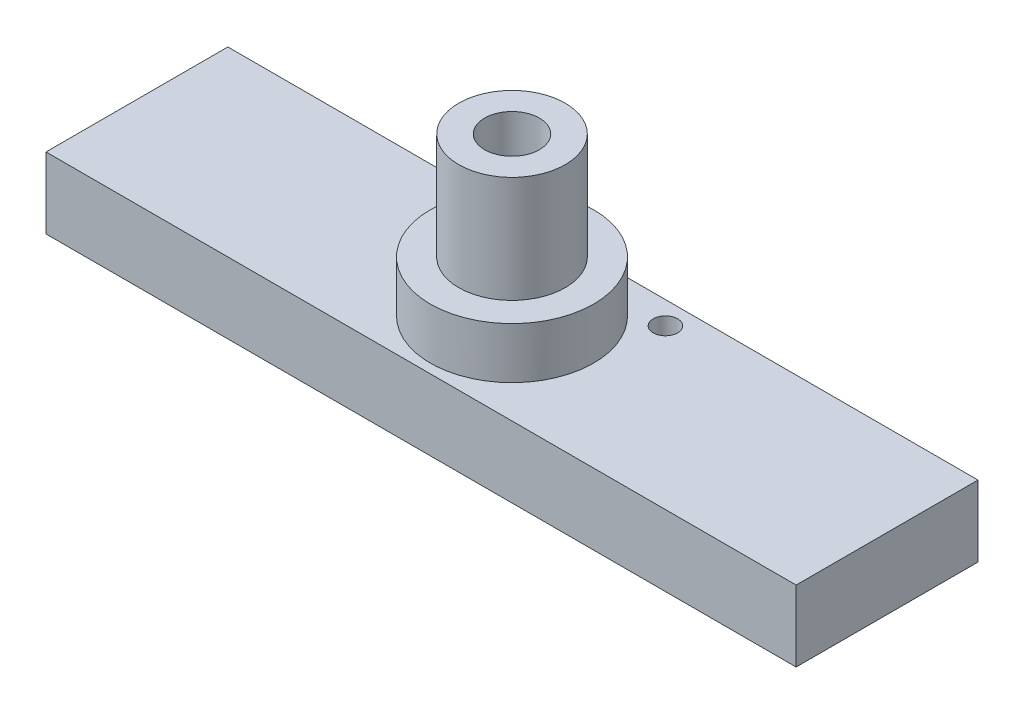
from build123d import *

# Parameters (mm, degrees)
SKETCH1_W           = 67.056
SKETCH1_H           = 16.256
BOSS_EXTRUDE1_DEPTH = 6.35
SKETCH2_R           = 4.7625
BOSS_EXTRUDE2_DEPTH = 14.097
SKETCH3_R           = 2.4511
CUT_EXTRUDE1_DEPTH  = 72.964188879
CUT_EXTRUDE2_REACH  = 73.964
SKETCH4_R           = 1.0922
SKETCH6_R           = 7.3025
SKETCH6_R_2         = 4.7625
BOSS_EXTRUDE3_DEPTH = 4.572


with BuildPart() as part:
    # Sketch1 → Boss-Extrude1 (new body)
    with BuildSketch(Plane(origin=(0, 0, 0), x_dir=(1, 0, 0), z_dir=(0, 1, 0))):
        with Locations((33.528, 8.128)):
            Rectangle(SKETCH1_W, SKETCH1_H)
    extrude(amount=BOSS_EXTRUDE1_DEPTH)

    # Sketch2 → Boss-Extrude2 (add)
    with BuildSketch(Plane(origin=(0, 6.35, 0), x_dir=(1, 0, 0), z_dir=(0, 1, 0))):
        with Locations(Location((33.528, 8.128, 0), (0, 0, 90))):
            Circle(SKETCH2_R)
    extrude(amount=BOSS_EXTRUDE2_DEPTH)

    # Sketch3 → Cut-Extrude1 (cut, through all)
    with BuildSketch(Plane(origin=(0, 20.447, 0), x_dir=(1, 0, 0), z_dir=(0, 1, 0))):
        with Locations(Location((33.528, 8.128, 0), (0, 0, 270))):
            Circle(SKETCH3_R)
    extrude(amount=-CUT_EXTRUDE1_DEPTH, mode=Mode.SUBTRACT)

    # Sketch4 → Cut-Extrude2 (cut, up to next)
    with BuildSketch(Plane(origin=(0, 0, 0), x_dir=(-1, 0, 0), z_dir=(0, -1, 0)), mode=Mode.PRIVATE) as cut_extrude2_sk1:
        with Locations(Location((-25.908, 14.224, 0), (0, 0, 90))):
            Circle(SKETCH4_R)
    cut_extrude2_tool1 = extrude(cut_extrude2_sk1.sketch, amount=-CUT_EXTRUDE2_REACH, mode=Mode.PRIVATE) & part.part
    # Sketch4 → Cut-Extrude2 (cut, up to next)
    with BuildSketch(Plane(origin=(0, 0, 0), x_dir=(-1, 0, 0), z_dir=(0, -1, 0)), mode=Mode.PRIVATE) as cut_extrude2_sk2:
        with Locations(Location((-41.148, 14.224, 0), (0, 0, 90))):
            Circle(SKETCH4_R)
    cut_extrude2_tool2 = extrude(cut_extrude2_sk2.sketch, amount=-CUT_EXTRUDE2_REACH, mode=Mode.PRIVATE) & part.part
    add(cut_extrude2_tool1.solids().sort_by_distance((25.908, 0, -14.224))[0], mode=Mode.SUBTRACT)
    add(cut_extrude2_tool2.solids().sort_by_distance((41.148, 0, -14.224))[0], mode=Mode.SUBTRACT)

    # Sketch6 → Boss-Extrude3 (add)
    with BuildSketch(Plane(origin=(0, 6.35, 0), x_dir=(1, 0, 0), z_dir=(0, 1, 0))):
        with Locations(Location((33.528, 8.128, 0), (0, 0, 90))):
            Circle(SKETCH6_R)
        with Locations(Location((33.528, 8.128, 0), (0, 0, 270))):
            Circle(SKETCH6_R_2, mode=Mode.SUBTRACT)
    extrude(amount=BOSS_EXTRUDE3_DEPTH)


solid = part.part
